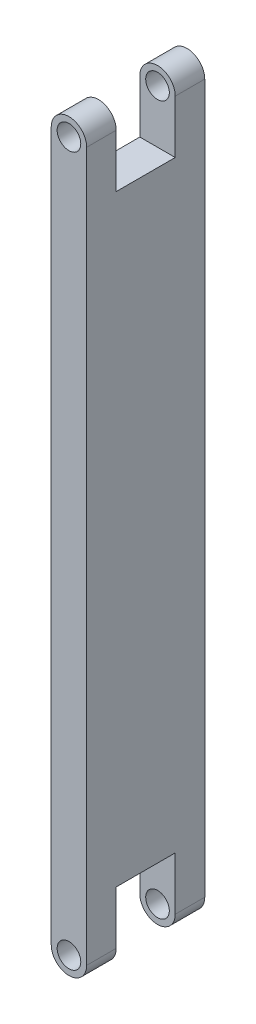
from build123d import *

# Parameters (mm, degrees)
EXTRUDE_1_DEPTH     = 50
SKETCH_2_W          = 25
SKETCH_2_H          = 30
CUT_EXTRUDE_1_DEPTH = 312.899422891
SKETCH_3_R          = 5
CUT_EXTRUDE_2_DEPTH = 312.628785577


with BuildPart() as part:
    # 草图1 → 凸台-拉伸1 (new body)
    with BuildSketch(Plane.XY):
        with BuildLine():
            Line((-7.5, 0), (-7.5, 300))
            ThreePointArc((-7.5, 300), (0, 307.5), (7.5, 300))
            Line((7.5, 300), (7.5, 0))
            ThreePointArc((7.5, 0), (0, -7.5), (-7.5, 0))
        make_face()
    extrude(amount=EXTRUDE_1_DEPTH)

    # 草图2 → 切除-拉伸1 (cut, through all)
    with BuildSketch(Plane(origin=(7.5, 0, 0), x_dir=(0, 0, -1), z_dir=(1, 0, 0))):
        with Locations((-25, 292.5)):
            Rectangle(SKETCH_2_W, SKETCH_2_H)
        with Locations((-25, 7.5)):
            Rectangle(SKETCH_2_W, SKETCH_2_H)
    extrude(amount=-CUT_EXTRUDE_1_DEPTH, mode=Mode.SUBTRACT)

    # 草图3 → 切除-拉伸2 (cut, through all)
    with BuildSketch(Plane.XY.offset(50)):
        with Locations((0, 300)):
            Circle(SKETCH_3_R)
        Circle(SKETCH_3_R)
    extrude(amount=-CUT_EXTRUDE_2_DEPTH, mode=Mode.SUBTRACT)


solid = part.part
